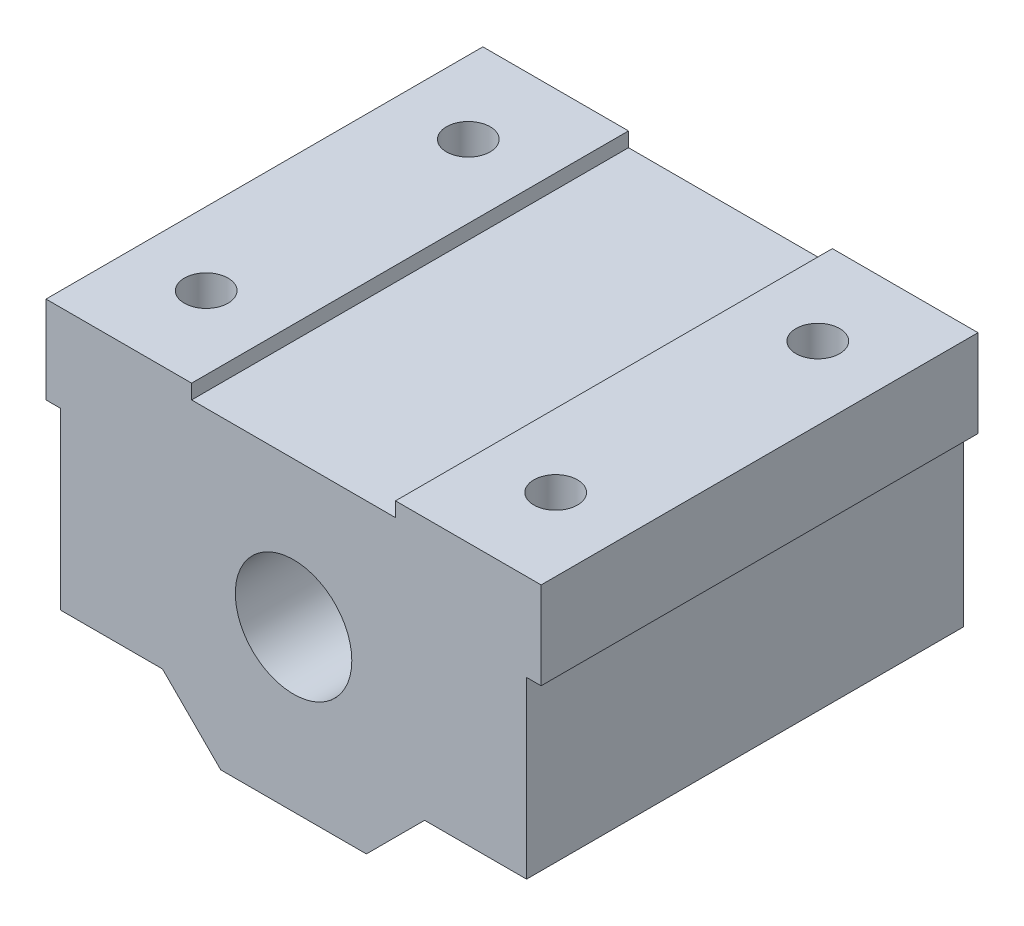
from build123d import *

# Parameters (mm, degrees)
SKETCH1_R           = 4
BOSS_EXTRUDE1_DEPTH = 30
SKETCH2_R           = 1.5
CUT_EXTRUDE1_DEPTH  = 30


with BuildPart() as part:
    # Sketch1 → Boss-Extrude1 (new body)
    with BuildSketch(Plane.XY):
        Polygon((-16, -7), (-9, -7), (-5, -11), (5, -11), (9, -7), (16, -7), (16, 5), (17, 5), (17, 11), (7, 11), (7, 10), (-7, 10), (-7, 11), (-17, 11), (-17, 5), (-16, 5), align=None)
        Circle(SKETCH1_R, mode=Mode.SUBTRACT)
    extrude(amount=BOSS_EXTRUDE1_DEPTH)

    # Sketch2 → Cut-Extrude1 (cut)
    with BuildSketch(Plane(origin=(0, 11, 0), x_dir=(-1, 0, 0), z_dir=(0, 1, 0))):
        with Locations(Location((12, 24, 0), (0, 0, 90))):
            Circle(SKETCH2_R)
        with Locations(Location((12, 6, 0), (0, 0, 90))):
            Circle(SKETCH2_R)
        with Locations(Location((-12, 24, 0), (0, 0, 90))):
            Circle(SKETCH2_R)
        with Locations(Location((-12, 6, 0), (0, 0, 90))):
            Circle(SKETCH2_R)
    extrude(amount=-CUT_EXTRUDE1_DEPTH, mode=Mode.SUBTRACT)


solid = part.part
